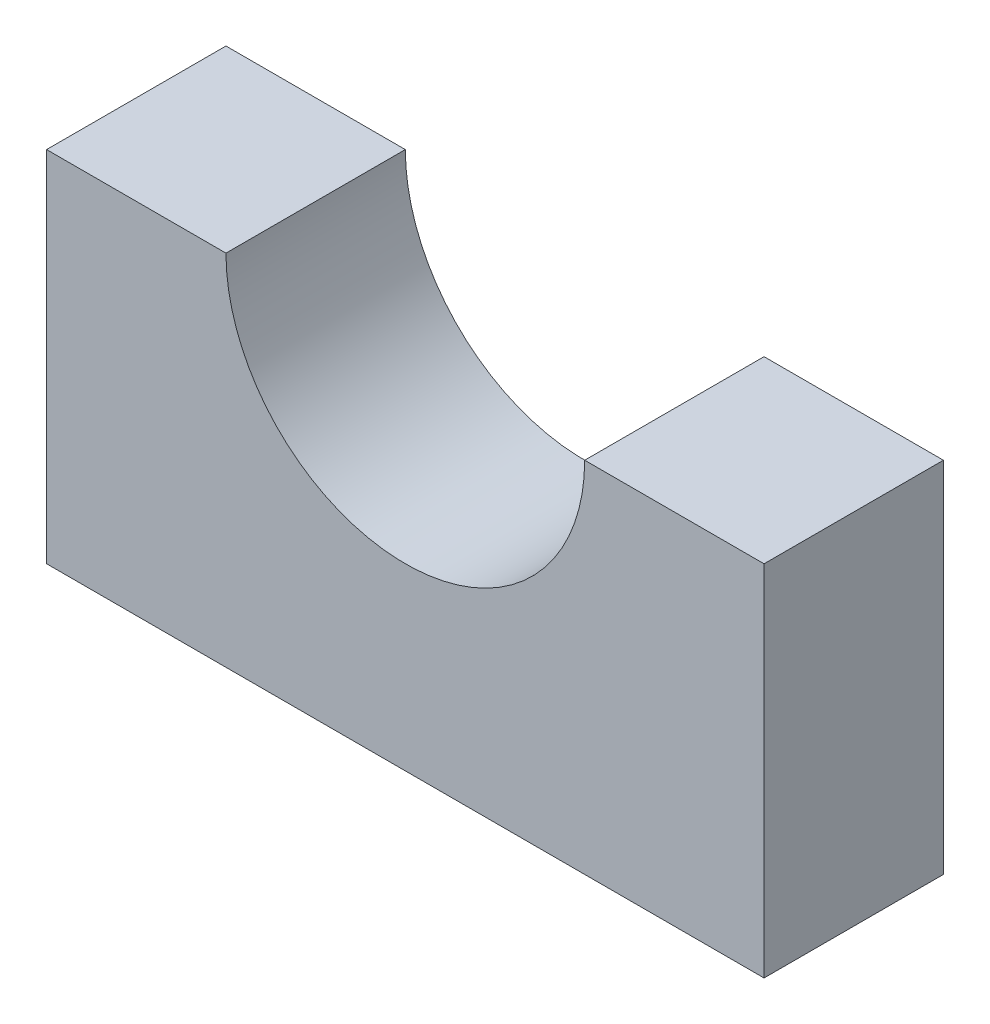
from build123d import *

# Parameters (mm, degrees)
BOSS_EXTRUDE1_DEPTH = 35


with BuildPart() as part:
    # Sketch1 → Boss-Extrude1 (new body)
    with BuildSketch(Plane.XY):
        with BuildLine():
            Line((105, 70), (140, 70))
            Line((140, 70), (140, 0))
            Line((140, 0), (0, 0))
            Line((0, 0), (0, 70))
            Line((0, 70), (35, 70))
            ThreePointArc((35, 70), (70, 35), (105, 70))
        make_face()
    extrude(amount=BOSS_EXTRUDE1_DEPTH)


solid = part.part
